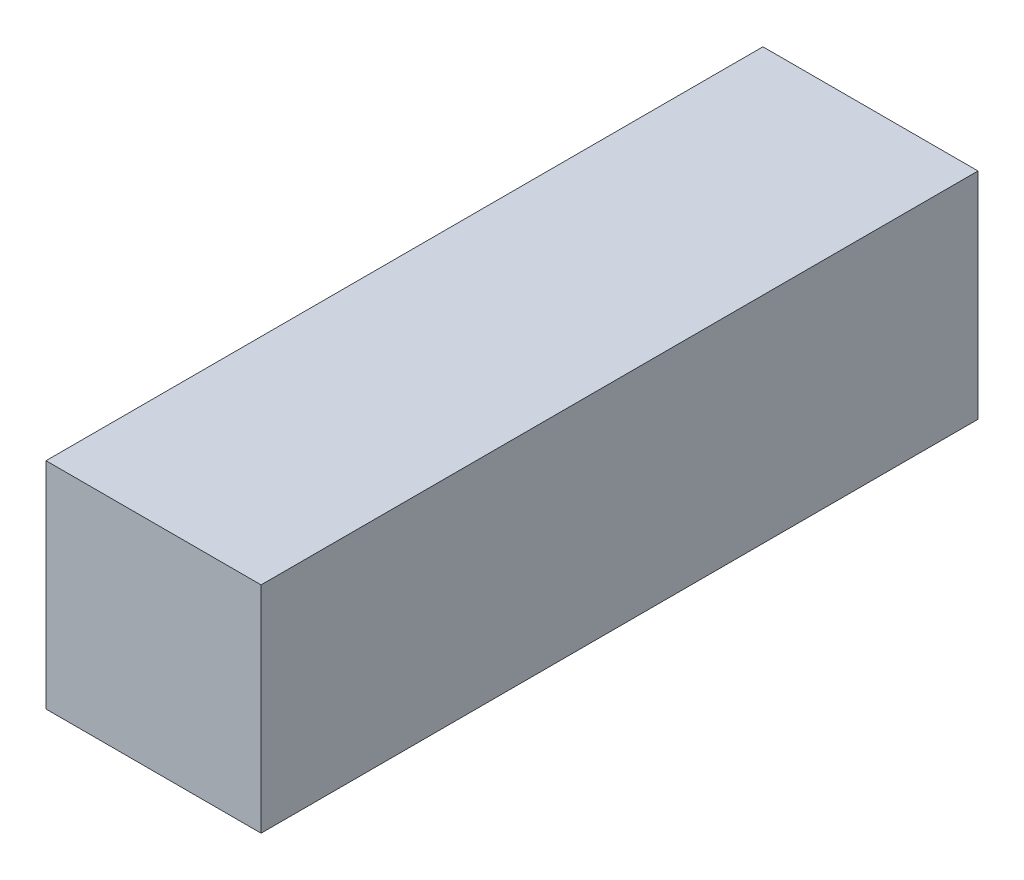
from build123d import *

# Parameters (mm, degrees)
SKETCH1_W           = 3
SKETCH1_H           = 3
BOSS_EXTRUDE1_DEPTH = 10


with BuildPart() as part:
    # Sketch1 → Boss-Extrude1 (new body)
    with BuildSketch(Plane.XY):
        Rectangle(SKETCH1_W, SKETCH1_H)
    extrude(amount=BOSS_EXTRUDE1_DEPTH)


solid = part.part
